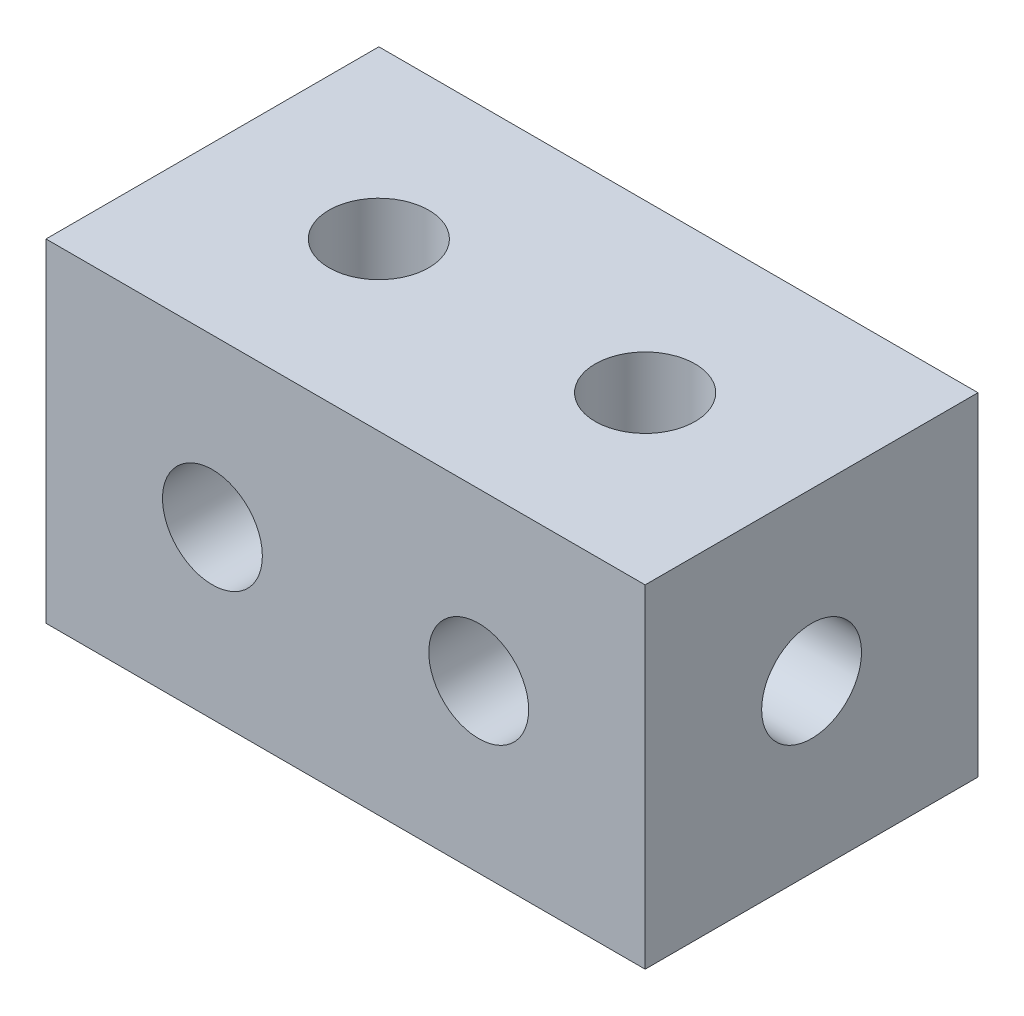
from build123d import *

# Parameters (mm, degrees)
SKETCH_1_W          = 18
SKETCH_1_H          = 10
SKETCH_1_R          = 1.5
EXTRUDE_1_DEPTH     = 10
SKETCH_2_R          = 1.5
CUT_EXTRUDE_1_DEPTH = 10
SKETCH_4_R          = 1.5
CUT_EXTRUDE_2_DEPTH = 25


with BuildPart() as part:
    # 草图1 → 凸台-拉伸1 (new body)
    with BuildSketch(Plane(origin=(0, 0, 0), x_dir=(1, 0, 0), z_dir=(0, 1, 0))):
        Rectangle(SKETCH_1_W, SKETCH_1_H)
        with Locations(Location((-4, 0, 0), (0, 0, 270))):
            Circle(SKETCH_1_R, mode=Mode.SUBTRACT)
        with Locations(Location((4, 0, 0), (0, 0, 270))):
            Circle(SKETCH_1_R, mode=Mode.SUBTRACT)
    extrude(amount=EXTRUDE_1_DEPTH)

    # 草图2 → 切除-拉伸1 (cut)
    with BuildSketch(Plane.XY.offset(5)):
        with Locations((-4, 5)):
            Circle(SKETCH_2_R)
        with Locations((4, 5)):
            Circle(SKETCH_2_R)
    extrude(amount=-CUT_EXTRUDE_1_DEPTH, mode=Mode.SUBTRACT)

    # 草图4 → 切除-拉伸2 (cut)
    with BuildSketch(Plane.ZY.offset(9)):
        with Locations(Location((0, 5, 0), (0, 0, 315))):
            Circle(SKETCH_4_R)
    extrude(amount=-CUT_EXTRUDE_2_DEPTH, mode=Mode.SUBTRACT)


solid = part.part
